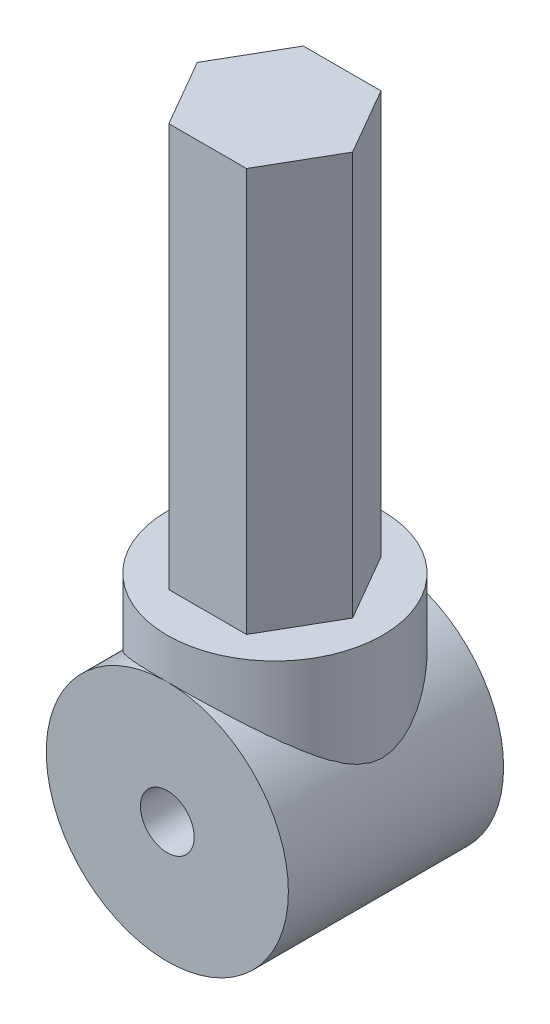
from build123d import *

# Parameters (mm, degrees)
SKETCH1_R           = 22.5
SKETCH1_R_2         = 5
BOSS_EXTRUDE1_DEPTH = 40
SKETCH2_R           = 20
BOSS_EXTRUDE2_DEPTH = 25
BOSS_EXTRUDE3_DEPTH = 25
BOSS_EXTRUDE4_DEPTH = 50


with BuildPart() as part:
    # Sketch1 → Boss-Extrude1 (new body)
    with BuildSketch(Plane.XY):
        Circle(SKETCH1_R)
        Circle(SKETCH1_R_2, mode=Mode.SUBTRACT)
    extrude(amount=BOSS_EXTRUDE1_DEPTH)


with BuildPart() as body_2:
    # Sketch2 → Boss-Extrude2 (new body)
    with BuildSketch(Plane(origin=(0, 5, 0), x_dir=(1, 0, 0), z_dir=(0, 1, 0))):
        with Locations(Location((0, -20, 0), (0, 0, 270))):
            Circle(SKETCH2_R)
    extrude(amount=BOSS_EXTRUDE2_DEPTH)

    # Sketch3 → Boss-Extrude3 (add)
    with BuildSketch(Plane(origin=(0, 30, 0), x_dir=(1, 0, 0), z_dir=(0, 1, 0))):
        Polygon((0, -20), (0, -7.5), (-7.216878365, -7.5), (-14.43375673, -20), (-7.216878365, -32.5), (7.216878365, -32.5), (14.43375673, -20), align=None)
        Polygon((7.216878365, -7.5), (0, -7.5), (0, -20), (14.43375673, -20), align=None)
    extrude(amount=BOSS_EXTRUDE3_DEPTH)

    # Sketch4 → Boss-Extrude4 (add)
    with BuildSketch(Plane(origin=(0, 55, 0), x_dir=(1, 0, 0), z_dir=(0, 1, 0))):
        Polygon((7.216878365, -32.5), (14.43375673, -20), (7.216878365, -7.5), (-7.216878365, -7.5), (-14.43375673, -20), (-7.216878365, -32.5), align=None)
    extrude(amount=BOSS_EXTRUDE4_DEPTH)


solid = Compound([part.part, body_2.part])
